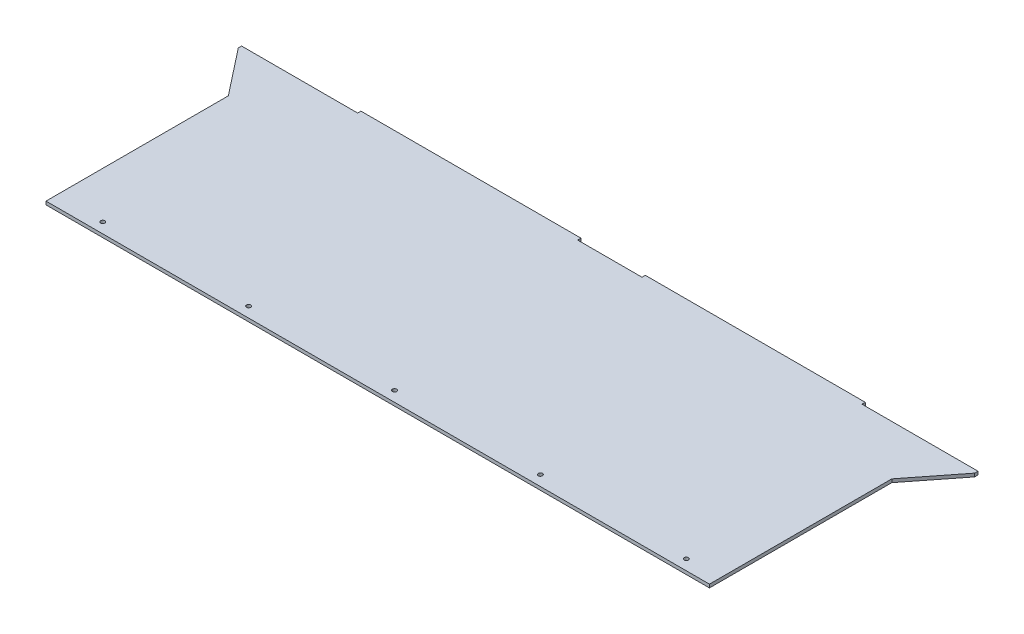
from build123d import *

# Parameters (mm, degrees)
SKETCH1_W           = 635.3556
SKETCH1_H           = 222.25
BOSS_EXTRUDE1_DEPTH = 1.5875
SKETCH2_W           = 210.6549
SKETCH2_H           = 3.175
BOSS_EXTRUDE2_DEPTH = 3.175
BOSS_EXTRUDE3_DEPTH = 3.175
CUT_EXTRUDE1_DEPTH  = 10
LPATTERN1_COUNT     = 5
LPATTERN1_PITCH     = 139.7


with BuildPart() as part:
    # Sketch1 → Boss-Extrude1 (new, symmetric)
    with BuildSketch(Plane(origin=(0, 0, 0), x_dir=(1, 0, 0), z_dir=(0, 1, 0))):
        Rectangle(SKETCH1_W, SKETCH1_H)
    extrude(amount=BOSS_EXTRUDE1_DEPTH, both=True)

    # Sketch2 → Boss-Extrude2 (add)
    with BuildSketch(Plane(origin=(0, 0, -111.125), x_dir=(-1, 0, 0), z_dir=(0, 0, -1))):
        with Locations((-136.15035, 0)):
            Rectangle(SKETCH2_W, SKETCH2_H)
        with Locations((136.15035, 0)):
            Rectangle(SKETCH2_W, SKETCH2_H)
    extrude(amount=BOSS_EXTRUDE2_DEPTH)

    # Sketch3 → Boss-Extrude3 (add)
    with BuildSketch(Plane(origin=(0, 1.5875, 0), x_dir=(1, 0, 0), z_dir=(0, 1, 0))):
        Polygon((-317.6778, 63.5), (-317.6778, 111.125), (-352.6028, 111.125), (-352.6028, 107.95), align=None)
    boss_extrude3 = extrude(amount=-BOSS_EXTRUDE3_DEPTH)

    # Mirror1: Boss-Extrude3 across plane
    add(boss_extrude3.mirror(Plane(origin=(0, 0, 0), x_dir=(0, 0, 1), z_dir=(1, 0, 0))))

    # Sketch4 → Cut-Extrude1 (cut)
    with BuildSketch(Plane(origin=(0, 1.5875, 0), x_dir=(1, 0, 0), z_dir=(0, 1, 0))):
        with BuildLine():
            ThreePointArc((-275.2528, -101.219), (-274.659691232, -102.650891232), (-273.2278, -103.244))
            Line((-273.2278, -103.244), (-273.2278, -101.219))
            Line((-273.2278, -101.219), (-275.2528, -101.219))
        make_face()
        with BuildLine():
            Line((-273.2278, -101.219), (-273.2278, -103.244))
            ThreePointArc((-273.2278, -103.244), (-271.795908768, -102.650891232), (-271.2028, -101.219))
            ThreePointArc((-271.2028, -101.219), (-273.2278, -99.194), (-275.2528, -101.219))
            Line((-275.2528, -101.219), (-273.2278, -101.219))
        make_face()
    cut_extrude1 = extrude(amount=-CUT_EXTRUDE1_DEPTH, mode=Mode.SUBTRACT)

    # LPattern1: Cut-Extrude1 ×5
    with Locations(*[(i * LPATTERN1_PITCH, 0, 0) for i in range(1, LPATTERN1_COUNT)]):
        add(cut_extrude1, mode=Mode.SUBTRACT)


solid = part.part
